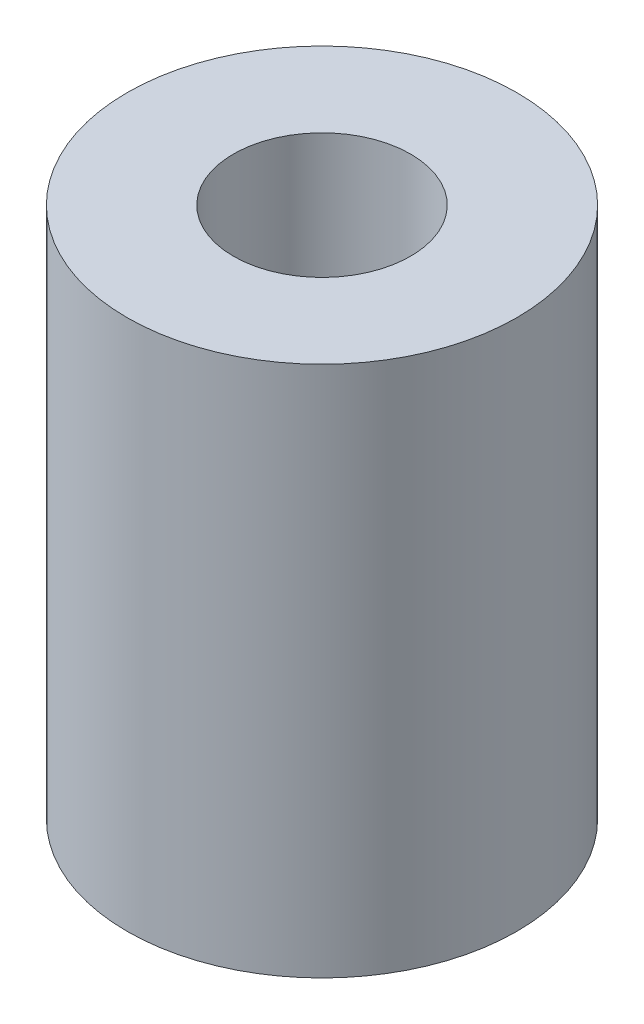
from build123d import *

# Parameters (mm, degrees)
SKETCH_2_R          = 11
EXTRUDE_1_DEPTH     = 15
SKETCH_3_R          = 2.5
CUT_EXTRUDE_1_DEPTH = 34.793490497
SKETCH_4_R          = 5
CUT_EXTRUDE_2_DEPTH = 20


with BuildPart() as part:
    # 스케치2 → 보스-돌출1 (new, symmetric)
    with BuildSketch(Plane(origin=(0, 0, 0), x_dir=(1, 0, 0), z_dir=(0, 1, 0))):
        with Locations(Location((0, 0, 0), (0, 0, 270))):
            Circle(SKETCH_2_R)
    extrude(amount=EXTRUDE_1_DEPTH, both=True)

    # 스케치3 → 컷-돌출1 (cut, through all)
    with BuildSketch(Plane.XZ.offset(15)):
        with Locations(Location((0, 0, 0), (0, 0, 270))):
            Circle(SKETCH_3_R)
    extrude(amount=-CUT_EXTRUDE_1_DEPTH, mode=Mode.SUBTRACT)

    # 스케치4 → 컷-돌출2 (cut)
    with BuildSketch(Plane(origin=(0, 15, 0), x_dir=(1, 0, 0), z_dir=(0, 1, 0))):
        with Locations(Location((0, 0, 0), (0, 0, 270))):
            Circle(SKETCH_4_R)
    extrude(amount=-CUT_EXTRUDE_2_DEPTH, mode=Mode.SUBTRACT)


solid = part.part
